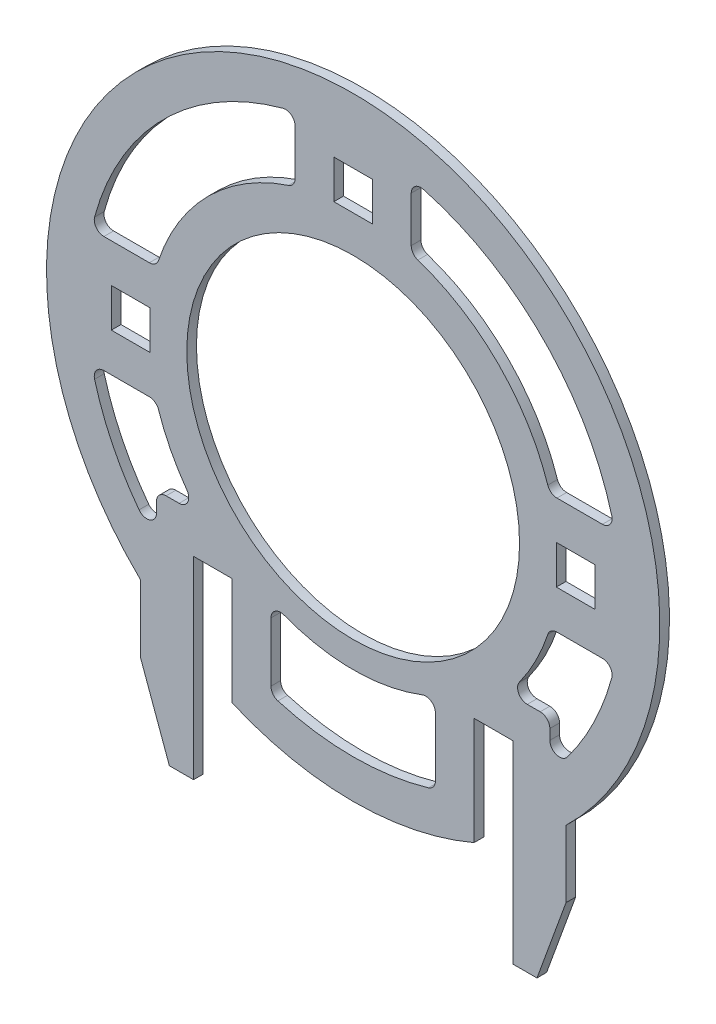
from build123d import *

# Parameters (mm, degrees)
ESQUISSE1_R        = 172
ESQUISSE1_W        = 40
ESQUISSE1_H        = 40
BOSS_EXTRU_1_DEPTH = 10
CONG_1_R           = 10


with BuildPart() as part:
    # Esquisse1 → Boss.-Extru.1 (new body)
    with BuildSketch(Plane.XY):
        with BuildLine():
            Line((220, -228.230147001), (220, -297.575677416))
            Line((220, -297.575677416), (190, -380))
            Line((190, -380), (165, -380))
            Line((165, -380), (165, -180))
            Line((165, -180), (125, -180))
            Line((125, -180), (125, -291.314263297))
            ThreePointArc((125, -291.314263297), (0, -317), (-125, -291.314263297))
            Line((-125, -291.314263297), (-125, -180))
            Line((-125, -180), (-165, -180))
            Line((-165, -180), (-165, -380))
            Line((-165, -380), (-190, -380))
            Line((-190, -380), (-220, -297.575677416))
            Line((-220, -297.575677416), (-220, -228.230147001))
            ThreePointArc((-220, -228.230147001), (0, 317), (220, -228.230147001))
        make_face()
        Circle(ESQUISSE1_R, mode=Mode.SUBTRACT)
        with Locations((230, 0)):
            Rectangle(ESQUISSE1_W, ESQUISSE1_H, mode=Mode.SUBTRACT)
        with BuildLine():
            Line((270.423741561, 60), (203.332240434, 60))
            ThreePointArc((203.332240434, 60), (149.906637612, 149.906637612), (60, 203.332240434))
            Line((60, 203.332240434), (60, 270.423741561))
            ThreePointArc((60, 270.423741561), (195.868578389, 195.868578389), (270.423741561, 60))
        make_face(mode=Mode.SUBTRACT)
        with BuildLine():
            Line((-60, 270.423741561), (-60, 203.332240434))
            ThreePointArc((-60, 203.332240434), (-149.906637612, 149.906637612), (-203.332240434, 60))
            Line((-203.332240434, 60), (-270.423741561, 60))
            ThreePointArc((-270.423741561, 60), (-195.868578389, 195.868578389), (-60, 270.423741561))
        make_face(mode=Mode.SUBTRACT)
        with BuildLine():
            Line((203.332240434, -60), (270.423741561, -60))
            ThreePointArc((270.423741561, -60), (245.385741824, -128.510068513), (203.332240434, -188.109010948))
            Line((203.332240434, -188.109010948), (203.332240434, -140))
            Line((203.332240434, -140), (159.197989937, -140))
            ThreePointArc((159.197989937, -140), (185.626081097, -102.405849524), (203.332240434, -60))
        make_face(mode=Mode.SUBTRACT)
        with Locations((-230, 0)):
            Rectangle(ESQUISSE1_W, ESQUISSE1_H, mode=Mode.SUBTRACT)
        with Locations((0, 230)):
            Rectangle(ESQUISSE1_W, ESQUISSE1_H, mode=Mode.SUBTRACT)
        with BuildLine():
            Line((-85, -180), (-85, -263.636112853))
            ThreePointArc((-85, -263.636112853), (0, -277), (85, -263.636112853))
            Line((85, -263.636112853), (85, -180))
            ThreePointArc((85, -180), (0, -199.060292374), (-85, -180))
        make_face(mode=Mode.SUBTRACT)
        with BuildLine():
            Line((-203.332240434, -60), (-270.423741561, -60))
            ThreePointArc((-270.423741561, -60), (-245.385741824, -128.510068513), (-203.332240434, -188.109010948))
            Line((-203.332240434, -188.109010948), (-203.332240434, -140))
            Line((-203.332240434, -140), (-159.197989937, -140))
            ThreePointArc((-159.197989937, -140), (-185.626081097, -102.405849524), (-203.332240434, -60))
        make_face(mode=Mode.SUBTRACT)
    extrude(amount=BOSS_EXTRU_1_DEPTH)

    # Congé1
    cong_1_edges = [part.edges().sort_by_distance(p)[0] for p in [
        (270.423741561, 60, 5),
        (60, 270.423741561, 5),
        (60, 203.332240434, 5),
        (203.332240434, 60, 5),
        (-60, 270.423741561, 5),
        (-270.423741561, 60, 5),
        (-203.332240434, 60, 5),
        (-60, 203.332240434, 5),
        (85, -180, 5),
        (-85, -180, 5),
        (-85, -263.636112853, 5),
        (85, -263.636112853, 5),
        (203.332240434, -60, 5),
        (159.197989937, -140, 5),
        (203.332240434, -140, 5),
        (203.332240434, -188.109010948, 5),
        (270.423741561, -60, 5),
        (-159.197989937, -140, 5),
        (-203.332240434, -60, 5),
        (-270.423741561, -60, 5),
        (-203.332240434, -188.109010948, 5),
        (-203.332240434, -140, 5),
    ]]
    fillet(cong_1_edges, radius=CONG_1_R)


solid = part.part
